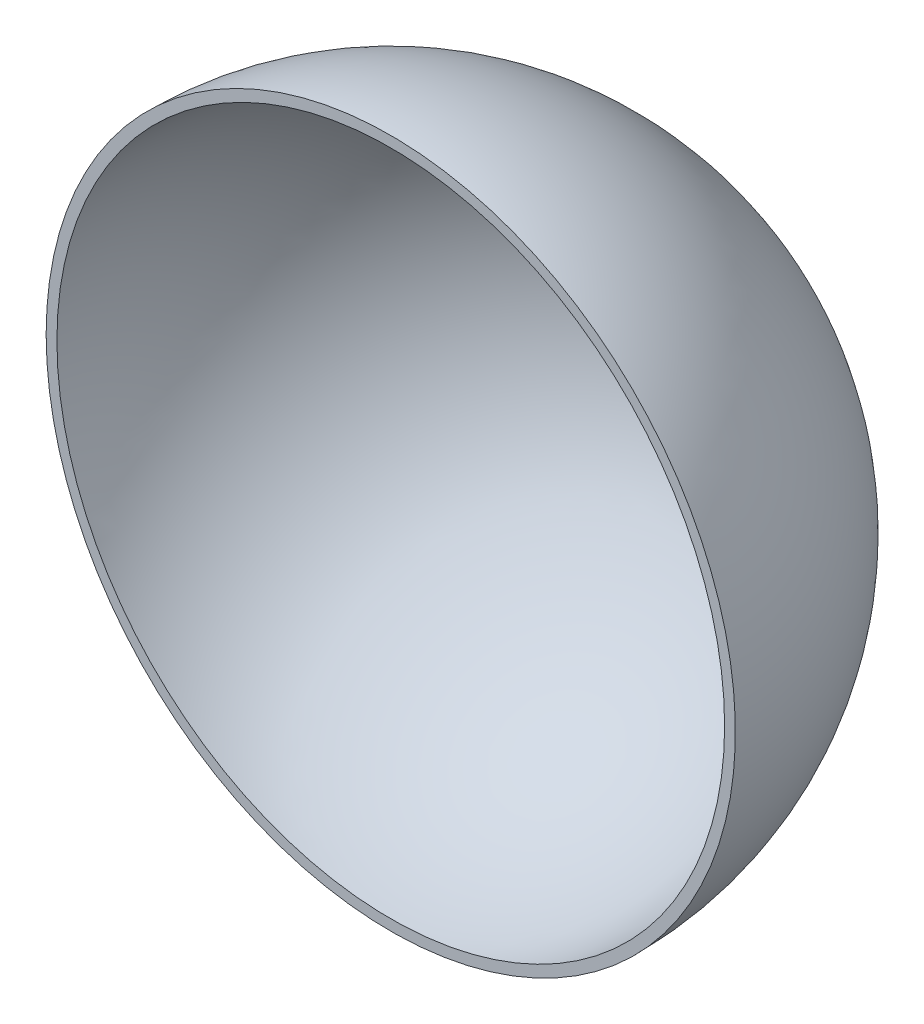
from build123d import *

# Parameters (mm, degrees)
REVOLVE5_ANGLE = 180


with BuildPart() as part:
    # Sketch1 → Revolve5 (revolve)
    with BuildSketch(Plane.XY):
        with BuildLine():
            Line((0, 310), (0, 320))
            ThreePointArc((0, 320), (-320, 0), (0, -320))
            Line((0, -320), (0, -310))
            ThreePointArc((0, -310), (-310, 0), (0, 310))
        make_face()
    revolve(axis=Axis((0, -310, 0), (0, -1, 0)), revolution_arc=REVOLVE5_ANGLE)


solid = part.part
